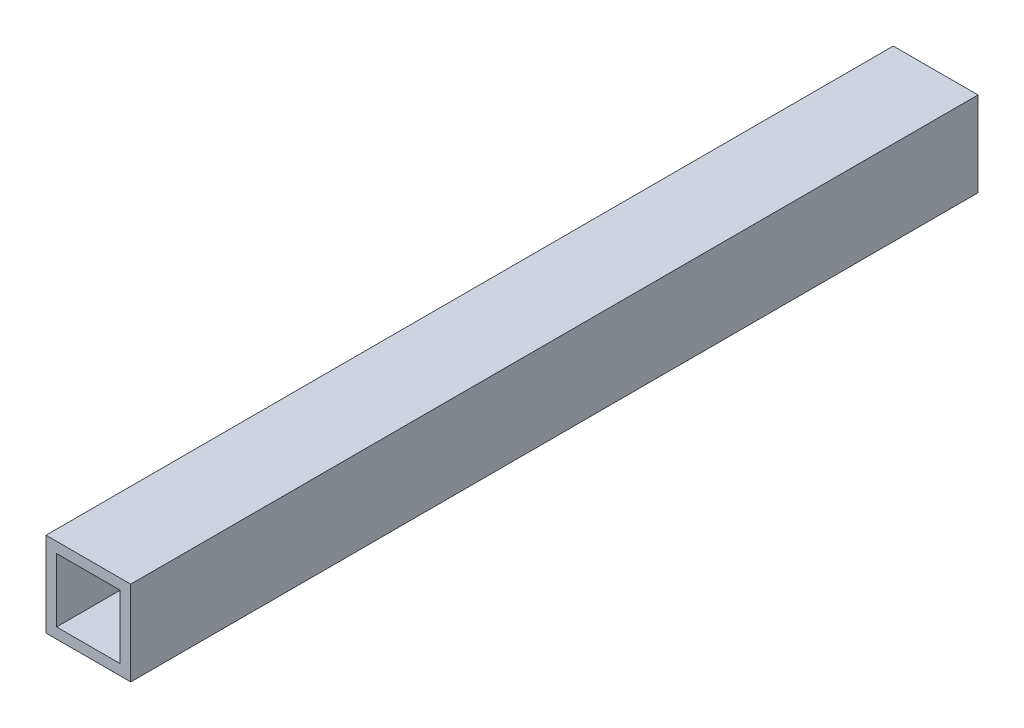
from build123d import *

# Parameters (mm, degrees)
ESQUISSE1_W        = 20
ESQUISSE1_H        = 20
ESQUISSE1_W_2      = 15
ESQUISSE1_H_2      = 15
BOSS_EXTRU_1_DEPTH = 200


with BuildPart() as part:
    # Esquisse1 → Boss.-Extru.1 (new body)
    with BuildSketch(Plane.XY):
        with Locations((10, 10)):
            Rectangle(ESQUISSE1_W, ESQUISSE1_H)
        with Locations((10, 10)):
            Rectangle(ESQUISSE1_W_2, ESQUISSE1_H_2, mode=Mode.SUBTRACT)
    extrude(amount=BOSS_EXTRU_1_DEPTH)


solid = part.part
